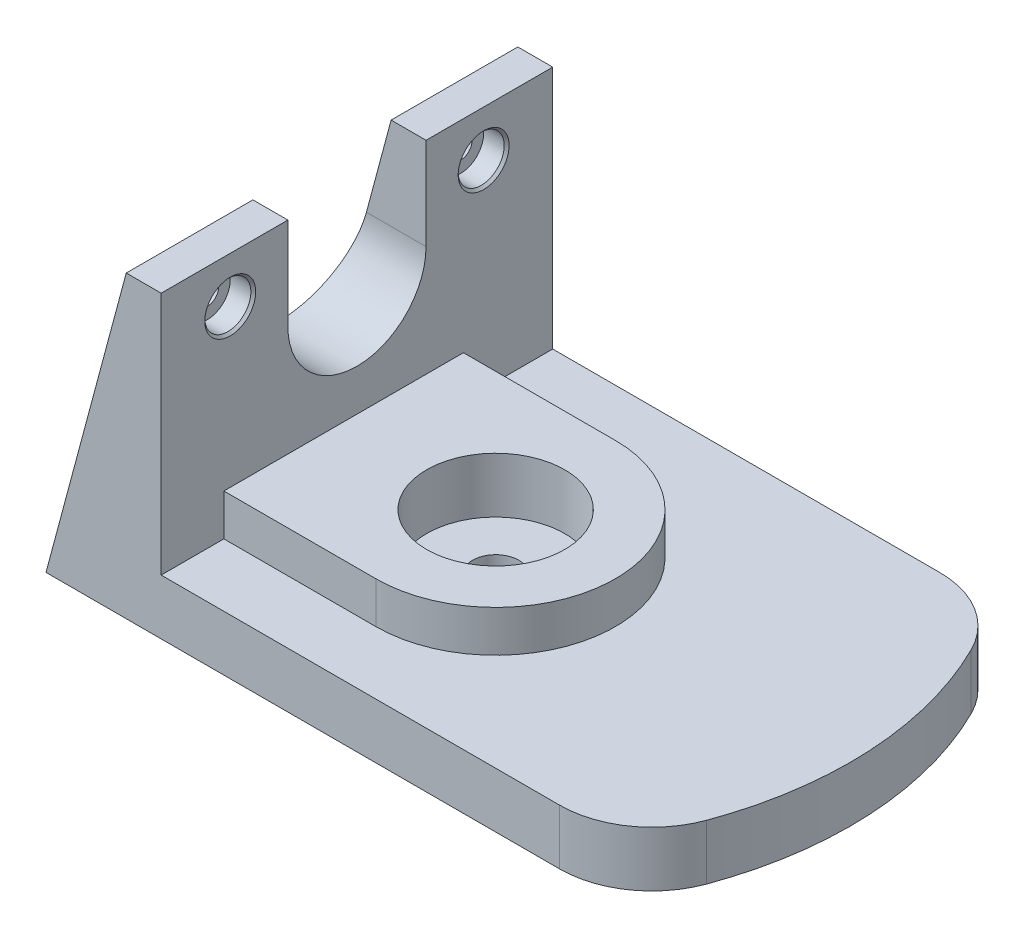
from build123d import *

# Parameters (mm, degrees)
P_IDAT_VYSUNUT_M1_DEPTH                           = 42.5
ODEBRAT_VYSUNUT_M1_DEPTH                          = 152.129911004
ODEBRAT_VYSUNUT_M1_DEPTH_BACK                     = 152.129911004
P_IDAT_VYSUNUT_M2_DEPTH                           = 9
ODEBRAT_VYSUNUT_M2_DEPTH                          = 135.652330095
ODEBRAT_VYSUNUT_M2_DEPTH_BACK                     = 135.652330095
V_LCOV_ZAHLOUBEN_PRO_M5_ROUBY_S_V_2_COUNT         = 2
V_LCOV_ZAHLOUBEN_PRO_M5_ROUBY_S_V_2_PITCH         = 27.950849719
V_LCOV_ZAHLOUBEN_PRO_M5_ROUBY_S_V_3_COUNT         = 2
V_LCOV_ZAHLOUBEN_PRO_M5_ROUBY_S_V_3_PITCH         = 27.950849719
V_LCOV_ZAHLOUBEN_PRO_M10_ROUBY_S_V_LC_D           = 10
V_LCOV_ZAHLOUBEN_PRO_M10_ROUBY_S_V_LC_CBORE_D     = 30
V_LCOV_ZAHLOUBEN_PRO_M10_ROUBY_S_V_LC_CBORE_DEPTH = 12
ZAOBLIT1_R                                        = 20


with BuildPart() as part:
    # Skica1 → Přidat vysunutím1 (new, symmetric)
    with BuildSketch(Plane.XY):
        Polygon((0, 0), (135, 0), (135, 12), (25, 12), (25, 65), (17.416697508, 65), align=None)
    extrude(amount=P_IDAT_VYSUNUT_M1_DEPTH, both=True)

    # Skica2 → Odebrat vysunutím1 (cut, two sides: drawn at the far end of the back side and taken through both)
    with BuildSketch(Plane(origin=(0, 12, 0), x_dir=(1, 0, 0), z_dir=(0, 1, 0)).offset(-ODEBRAT_VYSUNUT_M1_DEPTH_BACK)):
        with BuildLine():
            Line((-62.938175678, 293.50791206), (120.203054159, 42.5))
            ThreePointArc((120.203054159, 42.5), (134.922176639, 0.576231991), (124.027539054, -42.5))
            Line((124.027539054, -42.5), (-35.831632193, -308.940851505))
            Line((-35.831632193, -308.940851505), (584.976307558, -281.00825635))
            Line((584.976307558, -281.00825635), (557.869764074, 321.440507215))
            Line((557.869764074, 321.440507215), (-62.938175678, 293.50791206))
        make_face()
    extrude(amount=ODEBRAT_VYSUNUT_M1_DEPTH + ODEBRAT_VYSUNUT_M1_DEPTH_BACK, mode=Mode.SUBTRACT)

    # Skica3 → Přidat vysunutím2 (add)
    with BuildSketch(Plane(origin=(0, 12, 0), x_dir=(1, 0, 0), z_dir=(0, 1, 0))):
        with BuildLine():
            Line((25, 23.115200195), (58, 23.115200195))
            ThreePointArc((58, 23.115200195), (84, -2.884799805), (58, -28.884799805))
            Line((58, -28.884799805), (25, -28.884799805))
            Line((25, -28.884799805), (25, 23.115200195))
        make_face()
    extrude(amount=P_IDAT_VYSUNUT_M2_DEPTH)

    # Skica4 → Odebrat vysunutím2 (cut, two sides: drawn at the far end of the back side and taken through both)
    with BuildSketch(Plane(origin=(25, 0, 0), x_dir=(0, 0, -1), z_dir=(1, 0, 0)).offset(-ODEBRAT_VYSUNUT_M2_DEPTH_BACK)):
        with BuildLine():
            Line((15, 65), (15, 45))
            ThreePointArc((15, 45), (0, 30), (-15, 45))
            Line((-15, 45), (-15, 65))
            Line((-15, 65), (15, 65))
        make_face()
    extrude(amount=ODEBRAT_VYSUNUT_M2_DEPTH + ODEBRAT_VYSUNUT_M2_DEPTH_BACK, mode=Mode.SUBTRACT)

    # Skica9 → Válcové zahloubení pro M5 šrouby s válcovou hlavou zaoblenou1 (revolve, cut)
    with BuildSketch(Plane(origin=(25, 60, 0), x_dir=(0, 0, -1), z_dir=(0, 1, 0))):
        Polygon((0, 0), (0, 25), (2.5, 25), (2.5, 5), (5, 5), (5, 0.525), (5.525, 0), align=None)
    v_lcov_zahlouben_pro_m5_rouby_s_v_lco = revolve(axis=Axis((31.35, 60, 0), (-1, 0, 0)), mode=Mode.SUBTRACT)

    # V_lcov_ zahlouben_ pro M5 _rouby s v 2: Válcové zahloubení pro M5 šrouby s válcovou hlavou zaoblenou1 ×2
    with Locations(*[Vector(0, -0.1788854381999832, -0.9838699100999074) * (i * V_LCOV_ZAHLOUBEN_PRO_M5_ROUBY_S_V_2_PITCH) for i in range(1, V_LCOV_ZAHLOUBEN_PRO_M5_ROUBY_S_V_2_COUNT)]):
        add(v_lcov_zahlouben_pro_m5_rouby_s_v_lco, mode=Mode.SUBTRACT)

    # V_lcov_ zahlouben_ pro M5 _rouby s v 3: Válcové zahloubení pro M5 šrouby s válcovou hlavou zaoblenou1 ×2
    with Locations(*[Vector(0, -0.1788854381999834, 0.9838699100999074) * (i * V_LCOV_ZAHLOUBEN_PRO_M5_ROUBY_S_V_3_PITCH) for i in range(1, V_LCOV_ZAHLOUBEN_PRO_M5_ROUBY_S_V_3_COUNT)]):
        add(v_lcov_zahlouben_pro_m5_rouby_s_v_lco, mode=Mode.SUBTRACT)

    # Válcové zahloubení pro M10 šrouby s válcovou hlavou zaoblenou3 (through all)
    with Locations(Plane(origin=(0, 21, 0), x_dir=(1, 0, 0), z_dir=(0, 1, 0))):
        with Locations((58, -2.884799805)):
            CounterBoreHole(V_LCOV_ZAHLOUBEN_PRO_M10_ROUBY_S_V_LC_D / 2, V_LCOV_ZAHLOUBEN_PRO_M10_ROUBY_S_V_LC_CBORE_D / 2, V_LCOV_ZAHLOUBEN_PRO_M10_ROUBY_S_V_LC_CBORE_DEPTH)

    # Zaoblit1
    zaoblit1_edges = [part.edges().sort_by_distance(p)[0] for p in [
        (120.203054159, 6, -42.5),
        (124.027539054, 6, 42.5),
    ]]
    fillet(zaoblit1_edges, radius=ZAOBLIT1_R)


solid = part.part
